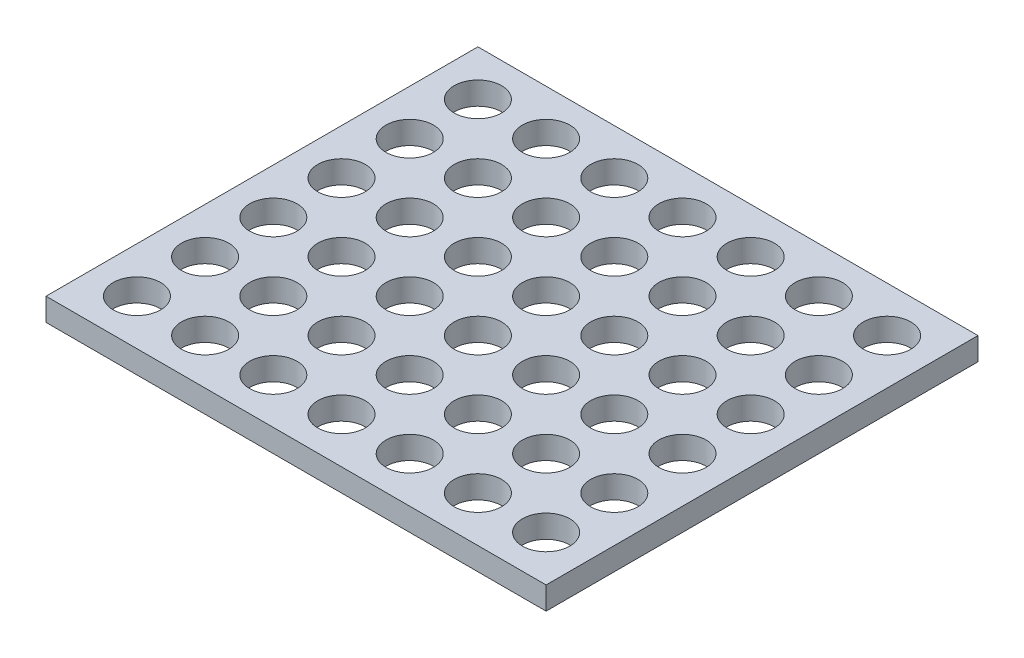
from build123d import *

# Parameters (mm, degrees)
SKETCH1_W           = 55.88
SKETCH1_H           = 48.26
SKETCH1_R           = 2.65
BOSS_EXTRUDE1_DEPTH = 2.54


with BuildPart() as part:
    # Sketch1 → Boss-Extrude1 (new body)
    with BuildSketch(Plane(origin=(0, 0, 0), x_dir=(1, 0, 0), z_dir=(0, 1, 0))):
        with Locations((22.86, 19.05)):
            Rectangle(SKETCH1_W, SKETCH1_H)
        with Locations(Location((0, 0, 0), (0, 0, 270))):
            Circle(SKETCH1_R, mode=Mode.SUBTRACT)
        with Locations(Location((7.62, 0, 0), (0, 0, 270))):
            Circle(SKETCH1_R, mode=Mode.SUBTRACT)
        with Locations(Location((15.24, 0, 0), (0, 0, 270))):
            Circle(SKETCH1_R, mode=Mode.SUBTRACT)
        with Locations(Location((22.86, 0, 0), (0, 0, 270))):
            Circle(SKETCH1_R, mode=Mode.SUBTRACT)
        with Locations(Location((30.48, 0, 0), (0, 0, 270))):
            Circle(SKETCH1_R, mode=Mode.SUBTRACT)
        with Locations(Location((38.1, 0, 0), (0, 0, 270))):
            Circle(SKETCH1_R, mode=Mode.SUBTRACT)
        with Locations(Location((45.72, 0, 0), (0, 0, 270))):
            Circle(SKETCH1_R, mode=Mode.SUBTRACT)
        with Locations(Location((7.62, 7.62, 0), (0, 0, 270))):
            Circle(SKETCH1_R, mode=Mode.SUBTRACT)
        with Locations(Location((15.24, 7.62, 0), (0, 0, 270))):
            Circle(SKETCH1_R, mode=Mode.SUBTRACT)
        with Locations(Location((22.86, 7.62, 0), (0, 0, 270))):
            Circle(SKETCH1_R, mode=Mode.SUBTRACT)
        with Locations(Location((30.48, 7.62, 0), (0, 0, 270))):
            Circle(SKETCH1_R, mode=Mode.SUBTRACT)
        with Locations(Location((38.1, 7.62, 0), (0, 0, 270))):
            Circle(SKETCH1_R, mode=Mode.SUBTRACT)
        with Locations(Location((45.72, 7.62, 0), (0, 0, 270))):
            Circle(SKETCH1_R, mode=Mode.SUBTRACT)
        with Locations(Location((7.62, 15.24, 0), (0, 0, 270))):
            Circle(SKETCH1_R, mode=Mode.SUBTRACT)
        with Locations(Location((15.24, 15.24, 0), (0, 0, 270))):
            Circle(SKETCH1_R, mode=Mode.SUBTRACT)
        with Locations(Location((22.86, 15.24, 0), (0, 0, 270))):
            Circle(SKETCH1_R, mode=Mode.SUBTRACT)
        with Locations(Location((30.48, 15.24, 0), (0, 0, 270))):
            Circle(SKETCH1_R, mode=Mode.SUBTRACT)
        with Locations(Location((38.1, 15.24, 0), (0, 0, 270))):
            Circle(SKETCH1_R, mode=Mode.SUBTRACT)
        with Locations(Location((45.72, 15.24, 0), (0, 0, 270))):
            Circle(SKETCH1_R, mode=Mode.SUBTRACT)
        with Locations(Location((7.62, 22.86, 0), (0, 0, 270))):
            Circle(SKETCH1_R, mode=Mode.SUBTRACT)
        with Locations(Location((15.24, 22.86, 0), (0, 0, 270))):
            Circle(SKETCH1_R, mode=Mode.SUBTRACT)
        with Locations(Location((22.86, 22.86, 0), (0, 0, 270))):
            Circle(SKETCH1_R, mode=Mode.SUBTRACT)
        with Locations(Location((30.48, 22.86, 0), (0, 0, 270))):
            Circle(SKETCH1_R, mode=Mode.SUBTRACT)
        with Locations(Location((38.1, 22.86, 0), (0, 0, 270))):
            Circle(SKETCH1_R, mode=Mode.SUBTRACT)
        with Locations(Location((45.72, 22.86, 0), (0, 0, 270))):
            Circle(SKETCH1_R, mode=Mode.SUBTRACT)
        with Locations(Location((7.62, 30.48, 0), (0, 0, 270))):
            Circle(SKETCH1_R, mode=Mode.SUBTRACT)
        with Locations(Location((15.24, 30.48, 0), (0, 0, 270))):
            Circle(SKETCH1_R, mode=Mode.SUBTRACT)
        with Locations(Location((22.86, 30.48, 0), (0, 0, 270))):
            Circle(SKETCH1_R, mode=Mode.SUBTRACT)
        with Locations(Location((30.48, 30.48, 0), (0, 0, 270))):
            Circle(SKETCH1_R, mode=Mode.SUBTRACT)
        with Locations(Location((38.1, 30.48, 0), (0, 0, 270))):
            Circle(SKETCH1_R, mode=Mode.SUBTRACT)
        with Locations(Location((45.72, 30.48, 0), (0, 0, 270))):
            Circle(SKETCH1_R, mode=Mode.SUBTRACT)
        with Locations(Location((7.62, 38.1, 0), (0, 0, 270))):
            Circle(SKETCH1_R, mode=Mode.SUBTRACT)
        with Locations(Location((15.24, 38.1, 0), (0, 0, 270))):
            Circle(SKETCH1_R, mode=Mode.SUBTRACT)
        with Locations(Location((22.86, 38.1, 0), (0, 0, 270))):
            Circle(SKETCH1_R, mode=Mode.SUBTRACT)
        with Locations(Location((30.48, 38.1, 0), (0, 0, 270))):
            Circle(SKETCH1_R, mode=Mode.SUBTRACT)
        with Locations(Location((38.1, 38.1, 0), (0, 0, 270))):
            Circle(SKETCH1_R, mode=Mode.SUBTRACT)
        with Locations(Location((45.72, 38.1, 0), (0, 0, 270))):
            Circle(SKETCH1_R, mode=Mode.SUBTRACT)
        with Locations(Location((0, 7.62, 0), (0, 0, 270))):
            Circle(SKETCH1_R, mode=Mode.SUBTRACT)
        with Locations(Location((0, 15.24, 0), (0, 0, 270))):
            Circle(SKETCH1_R, mode=Mode.SUBTRACT)
        with Locations(Location((0, 22.86, 0), (0, 0, 270))):
            Circle(SKETCH1_R, mode=Mode.SUBTRACT)
        with Locations(Location((0, 30.48, 0), (0, 0, 270))):
            Circle(SKETCH1_R, mode=Mode.SUBTRACT)
        with Locations(Location((0, 38.1, 0), (0, 0, 270))):
            Circle(SKETCH1_R, mode=Mode.SUBTRACT)
    extrude(amount=BOSS_EXTRUDE1_DEPTH)


solid = part.part
